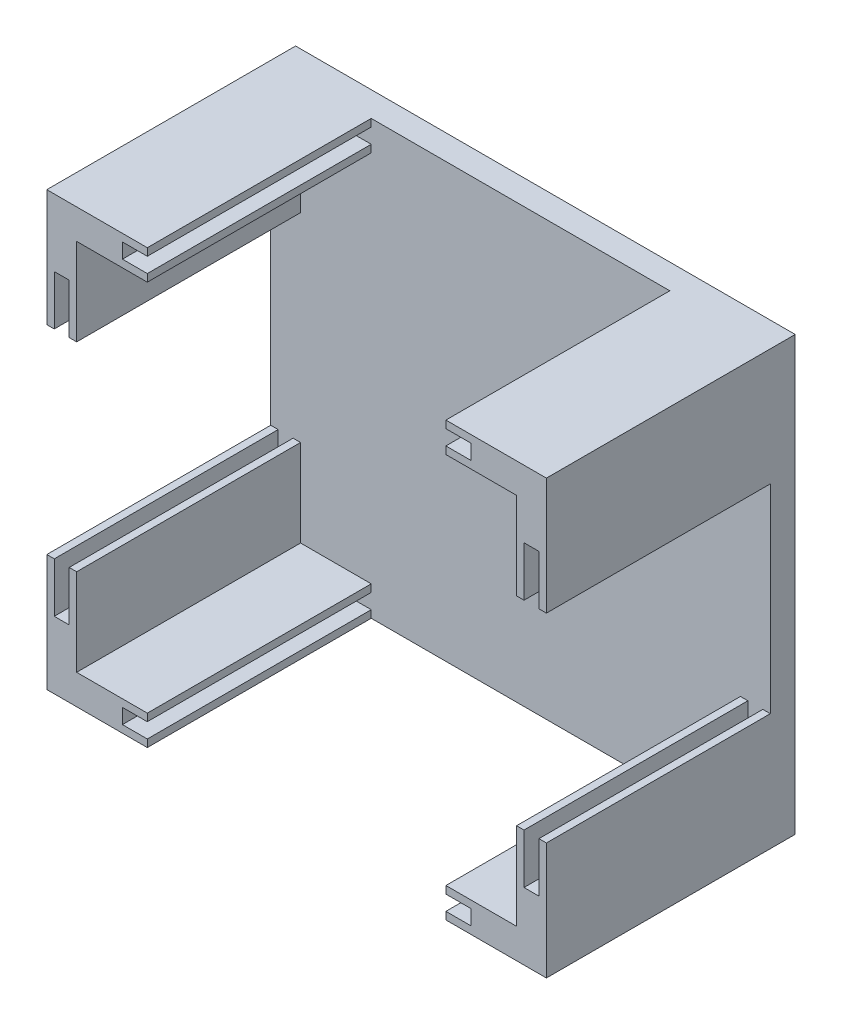
from build123d import *

# Parameters (mm, degrees)
ESQUISSE1_W             = 100.4
ESQUISSE1_H             = 87
BOSS_EXTRU_1_DEPTH      = 50
ESQUISSE3_W             = 88.4
ESQUISSE3_H             = 75
ENL_V_MAT_EXTRU_1_DEPTH = 45
ESQUISSE5_W             = 3
ESQUISSE5_H             = 60
ENL_V_MAT_EXTRU_2_DEPTH = 45
ESQUISSE7_W             = 70
ESQUISSE7_H             = 3
ENL_V_MAT_EXTRU_3_DEPTH = 45
ESQUISSE8_W             = 100.4
ESQUISSE8_H             = 40
ENL_V_MAT_EXTRU_4_DEPTH = 45
ESQUISSE9_W             = 60
ESQUISSE9_H             = 87
ENL_V_MAT_EXTRU_5_DEPTH = 45


with BuildPart() as part:
    # Esquisse1 → Boss.-Extru.1 (new body)
    with BuildSketch(Plane.XY):
        Rectangle(ESQUISSE1_W, ESQUISSE1_H)
    extrude(amount=BOSS_EXTRU_1_DEPTH)

    # Esquisse3 → Enlèv. mat.-Extru.1 (cut)
    with BuildSketch(Plane.XY.offset(50)):
        Rectangle(ESQUISSE3_W, ESQUISSE3_H)
    extrude(amount=-ENL_V_MAT_EXTRU_1_DEPTH, mode=Mode.SUBTRACT)

    # Esquisse5 → Enlèv. mat.-Extru.2 (cut)
    with BuildSketch(Plane.XY.offset(50)):
        with Locations((-47.2, 0)):
            Rectangle(ESQUISSE5_W, ESQUISSE5_H)
    enl_v_mat_extru_2 = extrude(amount=-ENL_V_MAT_EXTRU_2_DEPTH, mode=Mode.SUBTRACT)

    # Symétrie1: Enlèv. mat.-Extru.2 across plane
    add(enl_v_mat_extru_2.mirror(Plane(origin=(0, 0, 0), x_dir=(0, 0, 1), z_dir=(1, 0, 0))), mode=Mode.SUBTRACT)

    # Esquisse7 → Enlèv. mat.-Extru.3 (cut)
    with BuildSketch(Plane.XY.offset(50)):
        with Locations((0, 40.5)):
            Rectangle(ESQUISSE7_W, ESQUISSE7_H)
    enl_v_mat_extru_3 = extrude(amount=-ENL_V_MAT_EXTRU_3_DEPTH, mode=Mode.SUBTRACT)

    # Symétrie2: Enlèv. mat.-Extru.3 across plane
    add(enl_v_mat_extru_3.mirror(Plane.ZX), mode=Mode.SUBTRACT)

    # Esquisse8 → Enlèv. mat.-Extru.4 (cut)
    with BuildSketch(Plane.XY.offset(50)):
        Rectangle(ESQUISSE8_W, ESQUISSE8_H)
    extrude(amount=-ENL_V_MAT_EXTRU_4_DEPTH, mode=Mode.SUBTRACT)

    # Esquisse9 → Enlèv. mat.-Extru.5 (cut)
    with BuildSketch(Plane.XY.offset(50)):
        Rectangle(ESQUISSE9_W, ESQUISSE9_H)
    extrude(amount=-ENL_V_MAT_EXTRU_5_DEPTH, mode=Mode.SUBTRACT)


solid = part.part
